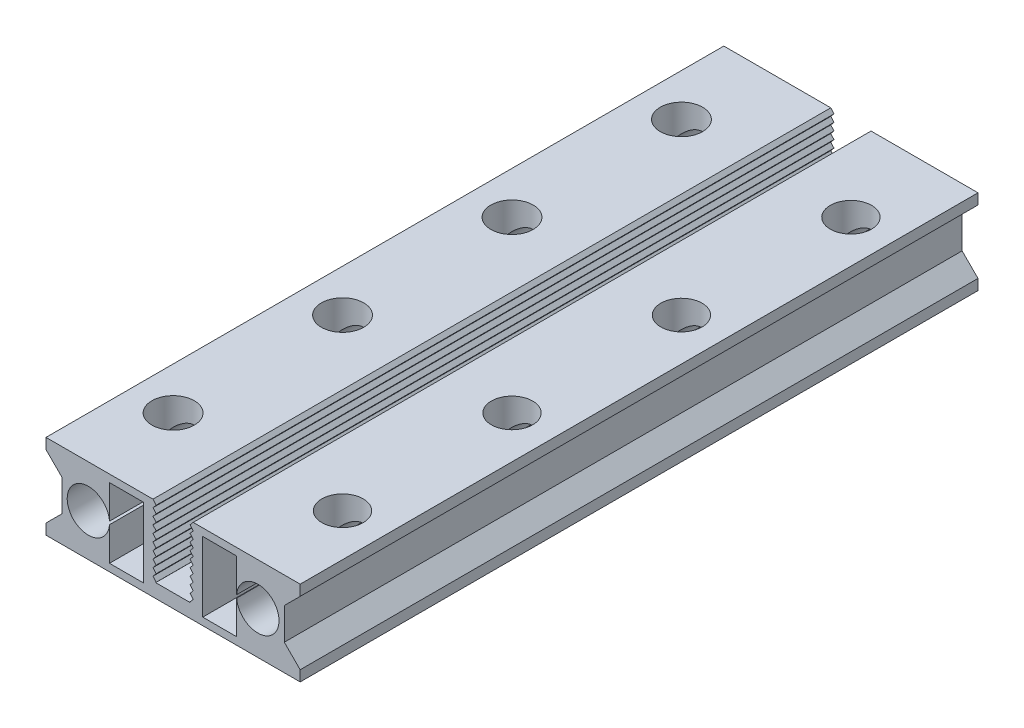
from build123d import *

# Parameters (mm, degrees)
EXTRUDE_2_DEPTH        = 64
EXTRUDE_3_DEPTH        = 64
PATTERN_LINEAR_1_COUNT = 10
PATTERN_LINEAR_1_PITCH = 0.7
MIRROR_1_COPY_1_DEPTH  = 64
MIRROR_1_COPY_2_DEPTH  = 64
MIRROR_1_COPY_3_DEPTH  = 64
MIRROR_1_COPY_4_DEPTH  = 64
MIRROR_1_COPY_5_DEPTH  = 64
MIRROR_1_COPY_6_DEPTH  = 64
MIRROR_1_COPY_7_DEPTH  = 64
MIRROR_1_COPY_8_DEPTH  = 64
MIRROR_1_COPY_9_DEPTH  = 64
SKETCH_4_R             = 2
SKETCH_4_R_2           = 1.95
CUT_EXTRUDE_1_DEPTH    = 66.604877867
PATTERN_LINEAR_2_COUNT = 4
PATTERN_LINEAR_2_PITCH = 16


with BuildPart() as part:
    # 草图1 → 凸台-拉伸2 (new body)
    with BuildSketch(Plane.XY):
        Polygon((-1.9, 8), (-12, 8), (-12, 7), (-10.5, 5.5), (-10.5, 2.5), (-12, 1), (-12, 0), (12, 0), (12, 1), (10.5, 2.5), (10.5, 5.5), (12, 7), (12, 8), (1.9, 8), (1.9, 1.3), (-1.9, 1.3), align=None)
        with BuildLine():
            Line((-6.005, 4.14133294), (-6.005, 7.3))
            Line((-6.005, 7.3), (-2.8, 7.3))
            Line((-2.8, 7.3), (-2.8, 0.7))
            Line((-2.8, 0.7), (-6.005, 0.7))
            Line((-6.005, 0.7), (-6.005, 3.85866706))
            ThreePointArc((-6.005, 3.85866706), (-10, 4), (-6.005, 4.14133294))
        make_face(mode=Mode.SUBTRACT)
        with BuildLine():
            Line((2.8, 0.7), (2.8, 7.3))
            Line((2.8, 7.3), (6.005, 7.3))
            Line((6.005, 7.3), (6.005, 4.14133294))
            ThreePointArc((6.005, 4.14133294), (10, 4), (6.005, 3.85866706))
            Line((6.005, 3.85866706), (6.005, 0.7))
            Line((6.005, 0.7), (2.8, 0.7))
        make_face(mode=Mode.SUBTRACT)
    extrude(amount=EXTRUDE_2_DEPTH)

    # 草图3 → 凸台-拉伸3 (add)
    with BuildSketch(Plane.XY.offset(64)):
        Polygon((-1.9, 8), (-1.6, 7.65), (-1.9, 7.3), align=None)
    extrude_3 = extrude(amount=-EXTRUDE_3_DEPTH)

    # 阵列(线性)1: 凸台-拉伸3 ×10
    with Locations(*[(0, -i * PATTERN_LINEAR_1_PITCH, 0) for i in range(1, PATTERN_LINEAR_1_COUNT)]):
        add(extrude_3)

    # 镜向1: 凸台-拉伸3 across plane
    add(extrude_3.mirror(Plane(origin=(0, 0, 0), x_dir=(0, 0, 1), z_dir=(1, 0, 0))))

    # 镜向1 copy 1 sketch → 镜向1 copy 1 (add)
    with BuildSketch(Plane(origin=(0, -0.7, 64), x_dir=(-1, 0, 0), z_dir=(0, 0, 1))):
        Polygon((-1.9, -8), (-1.6, -7.65), (-1.9, -7.3), align=None)
    extrude(amount=-MIRROR_1_COPY_1_DEPTH)

    # 镜向1 copy 2 sketch → 镜向1 copy 2 (add)
    with BuildSketch(Plane(origin=(0, -1.4, 64), x_dir=(-1, 0, 0), z_dir=(0, 0, 1))):
        Polygon((-1.9, -8), (-1.6, -7.65), (-1.9, -7.3), align=None)
    extrude(amount=-MIRROR_1_COPY_2_DEPTH)

    # 镜向1 copy 3 sketch → 镜向1 copy 3 (add)
    with BuildSketch(Plane(origin=(0, -2.1, 64), x_dir=(-1, 0, 0), z_dir=(0, 0, 1))):
        Polygon((-1.9, -8), (-1.6, -7.65), (-1.9, -7.3), align=None)
    extrude(amount=-MIRROR_1_COPY_3_DEPTH)

    # 镜向1 copy 4 sketch → 镜向1 copy 4 (add)
    with BuildSketch(Plane(origin=(0, -2.8, 64), x_dir=(-1, 0, 0), z_dir=(0, 0, 1))):
        Polygon((-1.9, -8), (-1.6, -7.65), (-1.9, -7.3), align=None)
    extrude(amount=-MIRROR_1_COPY_4_DEPTH)

    # 镜向1 copy 5 sketch → 镜向1 copy 5 (add)
    with BuildSketch(Plane(origin=(0, -3.5, 64), x_dir=(-1, 0, 0), z_dir=(0, 0, 1))):
        Polygon((-1.9, -8), (-1.6, -7.65), (-1.9, -7.3), align=None)
    extrude(amount=-MIRROR_1_COPY_5_DEPTH)

    # 镜向1 copy 6 sketch → 镜向1 copy 6 (add)
    with BuildSketch(Plane(origin=(0, -4.2, 64), x_dir=(-1, 0, 0), z_dir=(0, 0, 1))):
        Polygon((-1.9, -8), (-1.6, -7.65), (-1.9, -7.3), align=None)
    extrude(amount=-MIRROR_1_COPY_6_DEPTH)

    # 镜向1 copy 7 sketch → 镜向1 copy 7 (add)
    with BuildSketch(Plane(origin=(0, -4.9, 64), x_dir=(-1, 0, 0), z_dir=(0, 0, 1))):
        Polygon((-1.9, -8), (-1.6, -7.65), (-1.9, -7.3), align=None)
    extrude(amount=-MIRROR_1_COPY_7_DEPTH)

    # 镜向1 copy 8 sketch → 镜向1 copy 8 (add)
    with BuildSketch(Plane(origin=(0, -5.6, 64), x_dir=(-1, 0, 0), z_dir=(0, 0, 1))):
        Polygon((-1.9, -8), (-1.6, -7.65), (-1.9, -7.3), align=None)
    extrude(amount=-MIRROR_1_COPY_8_DEPTH)

    # 镜向1 copy 9 sketch → 镜向1 copy 9 (add)
    with BuildSketch(Plane(origin=(0, -6.3, 64), x_dir=(-1, 0, 0), z_dir=(0, 0, 1))):
        Polygon((-1.9, -8), (-1.6, -7.65), (-1.9, -7.3), align=None)
    extrude(amount=-MIRROR_1_COPY_9_DEPTH)

    # 草图4 → 切除-拉伸1 (cut, through all)
    with BuildSketch(Plane(origin=(0, 8, 0), x_dir=(1, 0, 0), z_dir=(0, 1, 0))):
        with Locations(Location((-8, -8, 0), (0, 0, 180))):
            Circle(SKETCH_4_R)
        with Locations(Location((8, -8, 0), (0, 0, 180))):
            Circle(SKETCH_4_R_2)
    cut_extrude_1 = extrude(amount=-CUT_EXTRUDE_1_DEPTH, mode=Mode.SUBTRACT)

    # 阵列(线性)2: 切除-拉伸1 ×4
    with Locations(*[(0, 0, i * PATTERN_LINEAR_2_PITCH) for i in range(1, PATTERN_LINEAR_2_COUNT)]):
        add(cut_extrude_1, mode=Mode.SUBTRACT)


solid = part.part
